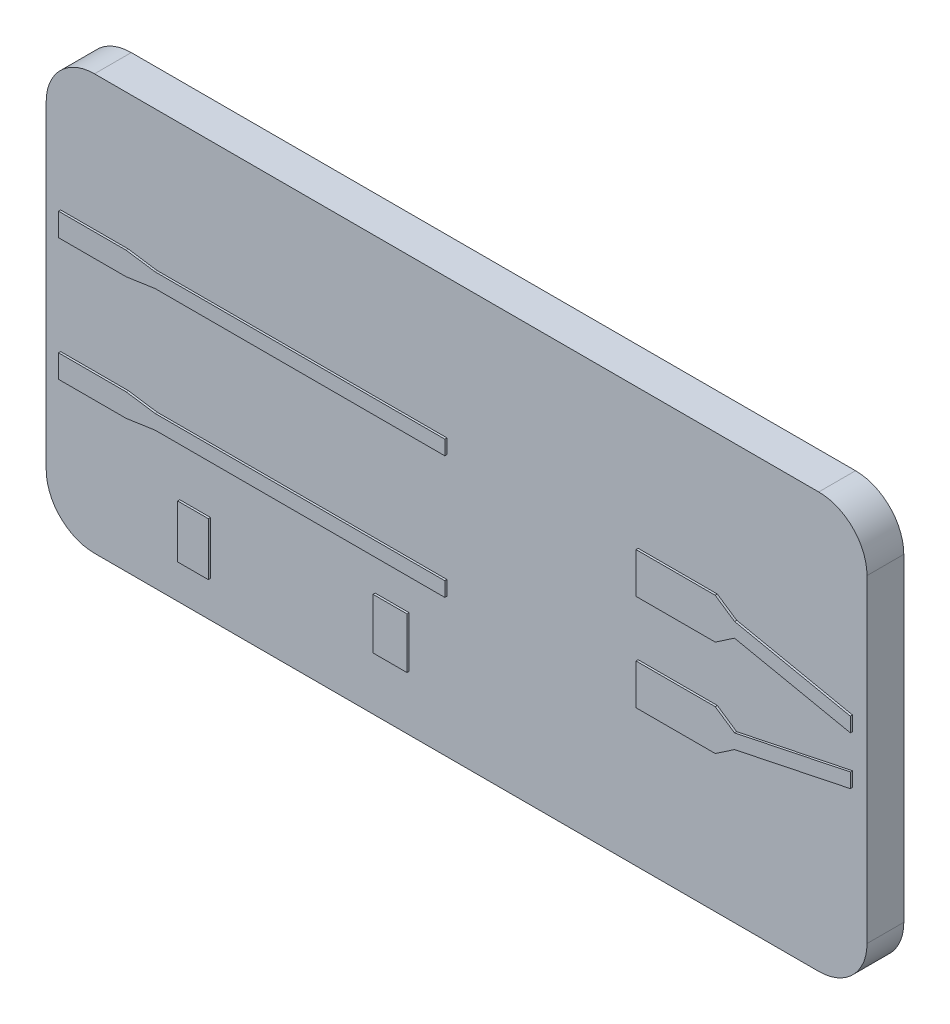
from build123d import *

# Parameters (mm, degrees)
BE_00_BOARD_DEPTH   = 0.381
SKETCH2_W           = 0.318200966
SKETCH2_H           = 0.54698776
SKETCH2_W_2         = 0.352186611
SKETCH2_H_2         = 0.526038031
BE_00_TRACES_DEPTH  = 0.022
BOSS_EXTRUDE1_DEPTH = 0.022


with BuildPart() as part:
    # Sketch1 → BE-00 Board (new body)
    with BuildSketch(Plane.XY):
        with BuildLine():
            Line((-8, 2.15), (-0.5, 2.15))
            ThreePointArc((-0.5, 2.15), (-0.146446609, 2.003553391), (0, 1.65))
            Line((0, 1.65), (0, -1.65))
            ThreePointArc((0, -1.65), (-0.146446609, -2.003553391), (-0.5, -2.15))
            Line((-0.5, -2.15), (-8, -2.15))
            ThreePointArc((-8, -2.15), (-8.353553391, -2.003553391), (-8.5, -1.65))
            Line((-8.5, -1.65), (-8.5, 1.65))
            ThreePointArc((-8.5, 1.65), (-8.353553391, 2.003553391), (-8, 2.15))
        make_face()
    extrude(amount=BE_00_BOARD_DEPTH)

    # Sketch2 → BE-00 Traces (add)
    with BuildSketch(Plane.XY.offset(0.381)):
        Polygon((-0.15, -0.17507), (-0.15, -0.32493), (-1.35, -0.57449), (-1.55024951, -0.70956), (-2.37, -0.70956), (-2.37, -0.28956), (-1.55024951, -0.28956), (-1.35, -0.42463), align=None)
        Polygon((-4.35, -0.56), (-7.35, -0.56), (-7.65, -0.516), (-8.35, -0.516), (-8.35, -0.754), (-7.65, -0.754), (-7.35, -0.71), (-4.35, -0.71), align=None)
        Polygon((-4.35, 0.71), (-4.35, 0.56), (-7.35, 0.56), (-7.65, 0.516), (-8.35, 0.516), (-8.35, 0.754), (-7.65, 0.754), (-7.35, 0.71), align=None)
        Polygon((-1.35, 0.42463), (-0.15, 0.17507), (-0.15, 0.32493), (-1.35, 0.57449), (-1.55024951, 0.70956), (-2.37, 0.70956), (-2.37, 0.28956), (-1.55024951, 0.28956), align=None)
        with Locations((-6.957835324, -1.501500363)):
            Rectangle(SKETCH2_W, SKETCH2_H)
        with Locations((-4.91735677, -1.316593308)):
            Rectangle(SKETCH2_W_2, SKETCH2_H_2)
    extrude(amount=BE_00_TRACES_DEPTH)

    # Sketch4 → Boss-Extrude1 (add)
    with BuildSketch(Plane(origin=(0, 0, 0), x_dir=(-1, 0, 0), z_dir=(0, 0, -1))):
        with BuildLine():
            Line((0.5, -2.05), (8, -2.05))
            ThreePointArc((8, -2.05), (8.282842712, -1.932842712), (8.4, -1.65))
            Line((8.4, -1.65), (8.4, 1.65))
            ThreePointArc((8.4, 1.65), (8.282842712, 1.932842712), (8, 2.05))
            Line((8, 2.05), (0.5, 2.05))
            ThreePointArc((0.5, 2.05), (0.217157288, 1.932842712), (0.1, 1.65))
            Line((0.1, 1.65), (0.1, -1.65))
            ThreePointArc((0.1, -1.65), (0.217157288, -1.932842712), (0.5, -2.05))
        make_face()
    extrude(amount=BOSS_EXTRUDE1_DEPTH)


solid = part.part
